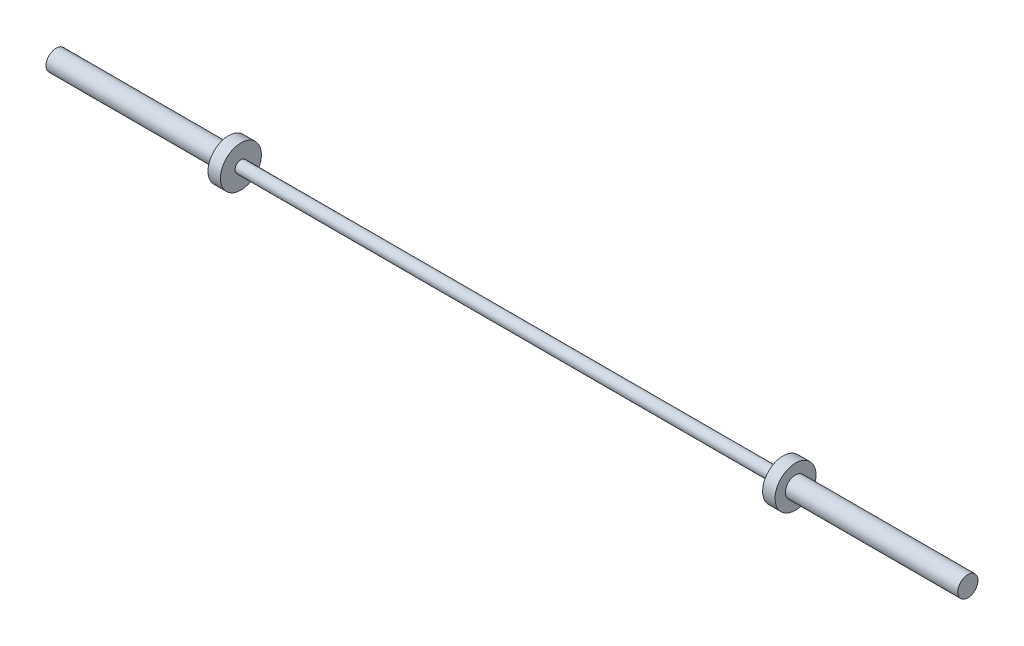
from build123d import *


with BuildPart() as part:
    # Sketch1 → Revolve1 (revolve)
    with BuildSketch(Plane.XY, mode=Mode.PRIVATE) as revolve1_sk:
        Polygon((1101.725, 32.41606814), (1101.725, 56.91606814), (685.165, 56.91606814), (685.165, 81.91606814), (655.165, 81.91606814), (655.165, 46.66606814), (-655.165, 46.66606814), (-655.165, 81.91606814), (-685.165, 81.91606814), (-685.165, 56.91606814), (-1101.725, 56.91606814), (-1101.725, 32.41606814), align=None)
    revolve(revolve1_sk.sketch.rotate(Axis((-1101.725, 32.41606814, 0), (1, 0, 0)), 180), axis=Axis((-1101.725, 32.41606814, 0), (1, 0, 0)))


solid = part.part
